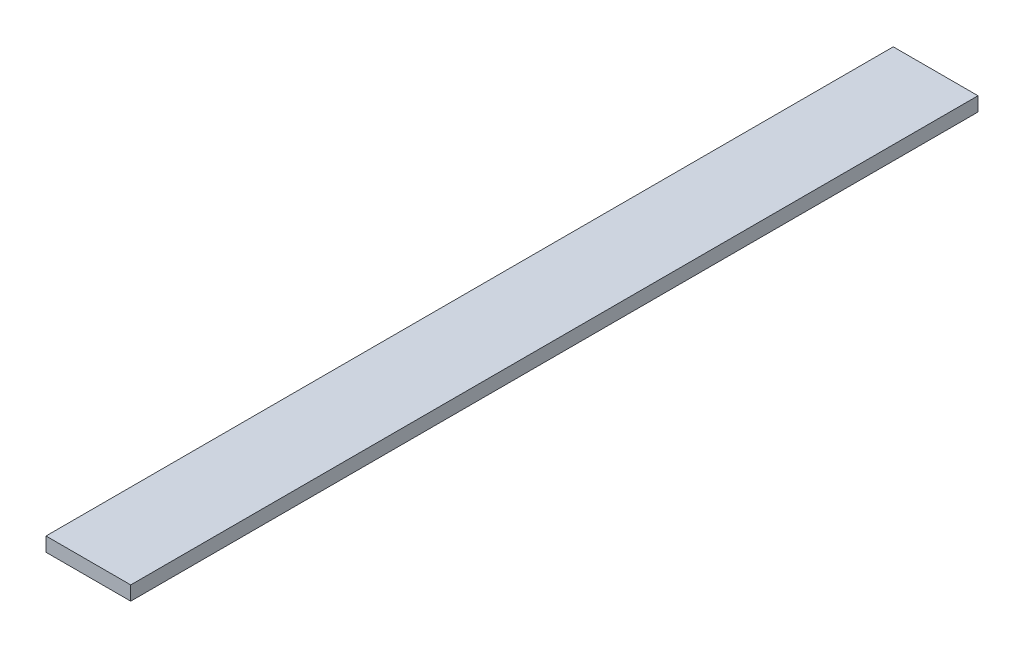
from build123d import *

# Parameters (mm, degrees)
SKETCH1_W           = 30
SKETCH1_H           = 300
BOSS_EXTRUDE1_DEPTH = 5


with BuildPart() as part:
    # Sketch1 → Boss-Extrude1 (new body)
    with BuildSketch(Plane(origin=(0, 0, 0), x_dir=(1, 0, 0), z_dir=(0, 1, 0))):
        Rectangle(SKETCH1_W, SKETCH1_H)
    extrude(amount=BOSS_EXTRUDE1_DEPTH)


solid = part.part
